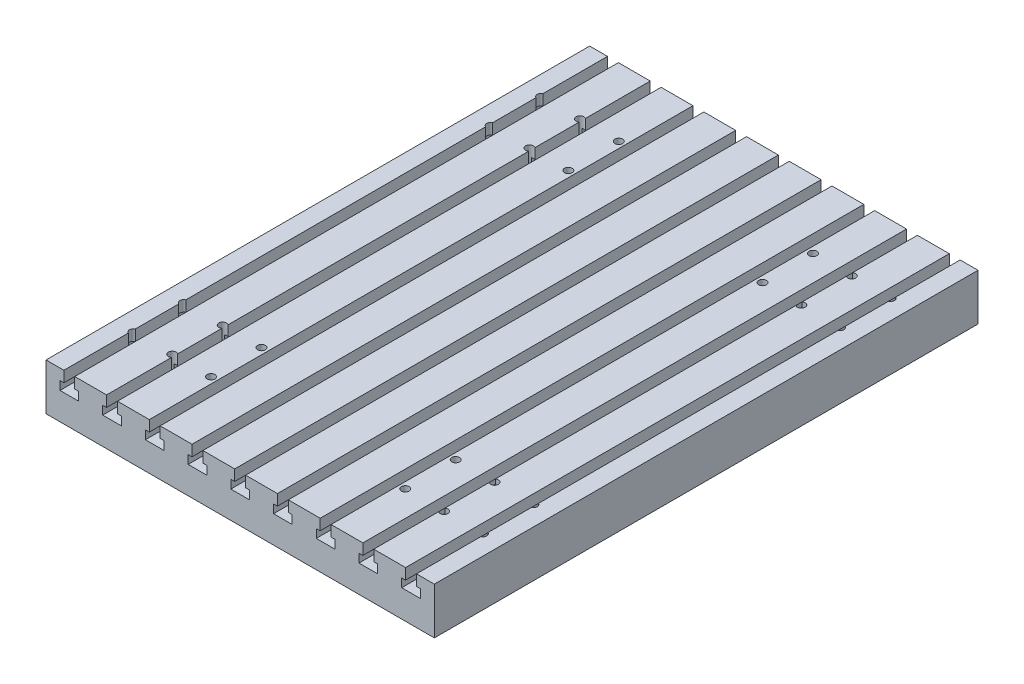
from build123d import *

# Parameters (mm, degrees)
SKETCH1_W                                           = 500
SKETCH1_H                                           = 60
BOSS_EXTRUDE1_DEPTH                                 = 350
CUT_EXTRUDE1_REACH                                  = 745.909
LPATTERN1_COUNT                                     = 5
LPATTERN1_PITCH                                     = 55
LPATTERN1_COL_COUNT                                 = 5
LPATTERN1_COL_PITCH                                 = 55
CBORE_FOR_M5_HEX_SOCKET_HEAD_CAP_SCREW1_D           = 5.5
CBORE_FOR_M5_HEX_SOCKET_HEAD_CAP_SCREW1_CBORE_D     = 10
CBORE_FOR_M5_HEX_SOCKET_HEAD_CAP_SCREW1_CBORE_DEPTH = 30.4
MIRROR1_AT_THE_SECOND_PLANE_COPY_1_D                = 5.5
MIRROR1_AT_THE_SECOND_PLANE_COPY_1_CBORE_D          = 10
MIRROR1_AT_THE_SECOND_PLANE_COPY_1_CBORE_DEPTH      = 30.4


with BuildPart() as part:
    # Sketch1 → Boss-Extrude1 (new, symmetric)
    with BuildSketch(Plane.XY):
        Rectangle(SKETCH1_W, SKETCH1_H)
    extrude(amount=BOSS_EXTRUDE1_DEPTH, both=True)

    # Sketch2 → Cut-Extrude1 (cut, up to next)
    with BuildSketch(Plane(origin=(0, 0, -350), x_dir=(-1, 0, 0), z_dir=(0, 0, -1)), mode=Mode.PRIVATE) as cut_extrude1_sk1:
        Polygon((7, 16), (12, 16), (12, 5), (-12, 5), (-12, 16), (-7, 16), (-7, 30), (7, 30), align=None)
    cut_extrude1_tool1 = extrude(cut_extrude1_sk1.sketch, amount=-CUT_EXTRUDE1_REACH, mode=Mode.PRIVATE) & part.part
    cut_extrude1 = cut_extrude1_tool1.solids().sort_by_distance((0, 15.826087, -350))[0]
    add(cut_extrude1, mode=Mode.SUBTRACT)

    # LPattern1: Cut-Extrude1 ×5
    with Locations(*[(i * LPATTERN1_PITCH, 0, 0) for i in range(1, LPATTERN1_COUNT)]):
        add(cut_extrude1, mode=Mode.SUBTRACT)

    # LPattern1 col: Cut-Extrude1 ×5
    with Locations(*[(-i * LPATTERN1_COL_PITCH, 0, 0) for i in range(1, LPATTERN1_COL_COUNT)]):
        add(cut_extrude1, mode=Mode.SUBTRACT)

    # CBORE for M5 Hex Socket Head Cap Screw1 (through all)
    with Locations(Plane(origin=(0, 30, 0), x_dir=(1, 0, 0), z_dir=(0, 1, 0))):
        with Locations((224.999999995, 262.5), (174.999999995, 262.5), (124.999999995, 262.5), (124.999999995, 197.5), (174.999999995, 197.5), (224.999999995, 197.5)):
            cbore_for_m5_hex_socket_head_cap_screw1 = CounterBoreHole(CBORE_FOR_M5_HEX_SOCKET_HEAD_CAP_SCREW1_D / 2, CBORE_FOR_M5_HEX_SOCKET_HEAD_CAP_SCREW1_CBORE_D / 2, CBORE_FOR_M5_HEX_SOCKET_HEAD_CAP_SCREW1_CBORE_DEPTH)

    # Mirror1: CBORE for M5 Hex Socket Head Cap Screw1 across plane
    add(cbore_for_m5_hex_socket_head_cap_screw1.mirror(Plane(origin=(0, 0, 0), x_dir=(0, 0, 1), z_dir=(1, 0, 0))), mode=Mode.SUBTRACT)

    # Mirror1 at the second plane: CBORE for M5 Hex Socket Head Cap Screw1 across plane
    add(cbore_for_m5_hex_socket_head_cap_screw1.mirror(Plane.XY), mode=Mode.SUBTRACT)

    # Mirror1 at the second plane copy 1 (through all)
    with Locations(Plane(origin=(0, 30, 0), x_dir=(-1, 0, 0), z_dir=(0, 1, 0))):
        with Locations((224.999999995, 262.5), (174.999999995, 262.5), (124.999999995, 262.5), (124.999999995, 197.5), (174.999999995, 197.5), (224.999999995, 197.5)):
            CounterBoreHole(MIRROR1_AT_THE_SECOND_PLANE_COPY_1_D / 2, MIRROR1_AT_THE_SECOND_PLANE_COPY_1_CBORE_D / 2, MIRROR1_AT_THE_SECOND_PLANE_COPY_1_CBORE_DEPTH)


solid = part.part
